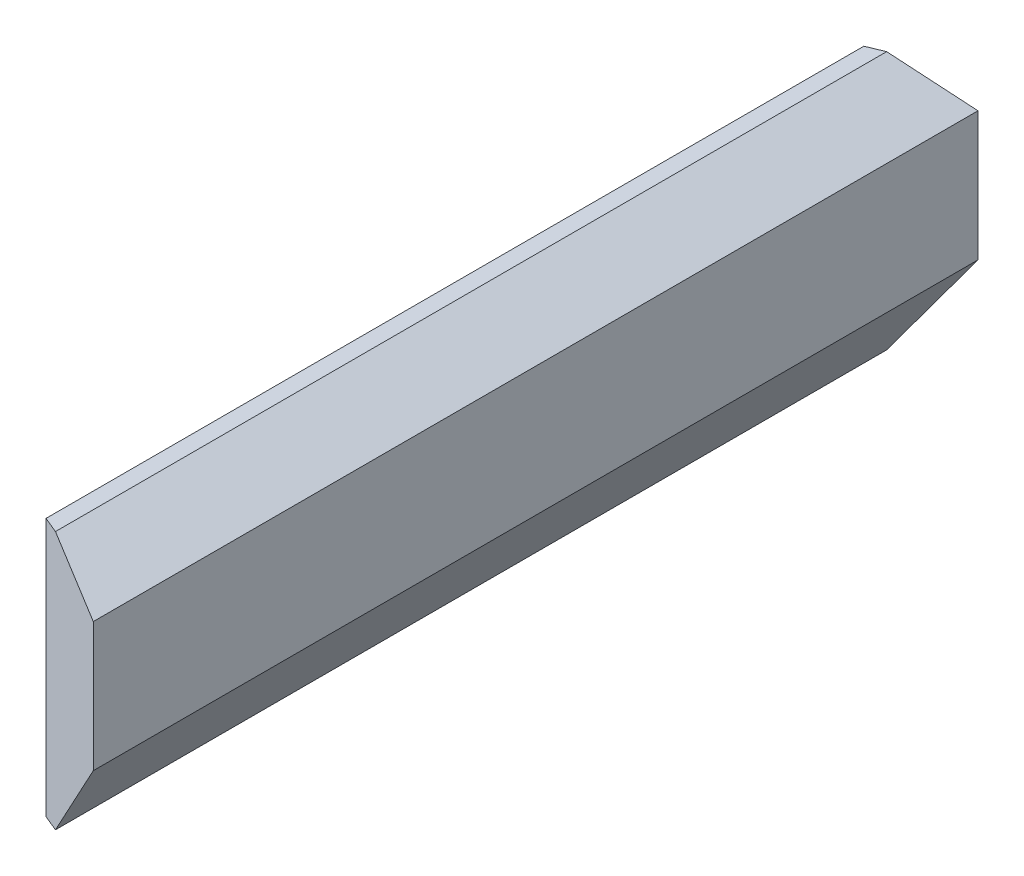
from build123d import *

# Parameters (mm, degrees)
EXTRUDE_1_DEPTH     = 300
CUT_EXTRUDE_1_DEPTH = 290
CUT_EXTRUDE_3_DEPTH = 53
CUT_EXTRUDE_4_DEPTH = 60
CUT_EXTRUDE_5_DEPTH = 53
CUT_EXTRUDE_6_DEPTH = 60


with BuildPart() as part:
    # 草图1 → 拉伸1 (new body)
    with BuildSketch(Plane.XY):
        Polygon((0, 0), (0, 80), (5, 80), (25, 70), (25, 30), (5, 0), align=None)
    extrude(amount=EXTRUDE_1_DEPTH)

    # 草图2 → 切除-拉伸1 (cut)
    with BuildSketch(Plane(origin=(0, 80, 0), x_dir=(-1, 0, 0), z_dir=(0, 1, 0))):
        Polygon((0, 276.65), (-136.816544737, 333.321268387), (0, 333.321268387), align=None)
        Polygon((0, 0), (0, 23.35), (-107.528203225, -21.189640114), (0, -21.189640114), align=None)
    extrude(amount=-CUT_EXTRUDE_1_DEPTH, mode=Mode.SUBTRACT)

    # 草图5 → 切除-拉伸3 (cut)
    with BuildSketch(Plane.XY.offset(28.35)):
        Polygon((0, 75), (6.05572809, 75), (21, 67.527864045), (21, 31.211102551), (3.525931633, 5), (0, 5), align=None)
    extrude(amount=CUT_EXTRUDE_3_DEPTH, mode=Mode.SUBTRACT)

    # 草图6 → 切除-拉伸4 (cut)
    with BuildSketch(Plane.XY.offset(86.35)):
        Polygon((0, 75), (6.05572809, 75), (21, 67.527864045), (21, 31.211102551), (3.525931633, 5), (0, 5), align=None)
    extrude(amount=CUT_EXTRUDE_4_DEPTH, mode=Mode.SUBTRACT)

    # 草图7 → 切除-拉伸5 (cut)
    with BuildSketch(Plane.XY.offset(218.65)):
        Polygon((0, 75), (6.05572809, 75), (21, 67.527864045), (21, 31.211102551), (3.525931633, 5), (0, 5), align=None)
    extrude(amount=CUT_EXTRUDE_5_DEPTH, mode=Mode.SUBTRACT)

    # 草图8 → 切除-拉伸6 (cut)
    with BuildSketch(Plane.XY.offset(213.65)):
        Polygon((0, 75), (6.05572809, 75), (21, 67.527864045), (21, 31.211102551), (3.525931633, 5), (0, 5), align=None)
    extrude(amount=-CUT_EXTRUDE_6_DEPTH, mode=Mode.SUBTRACT)


solid = part.part
